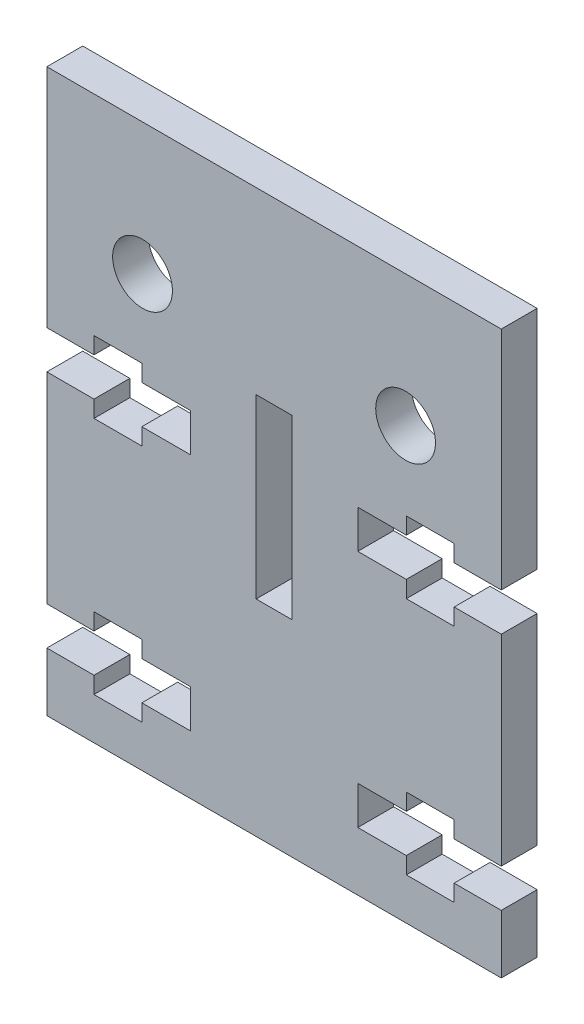
from build123d import *

# Parameters (mm, degrees)
SKETCH1_W           = 38
SKETCH1_H           = 47
BOSS_EXTRUDE1_DEPTH = 3
SKETCH2_R           = 2.5
CUT_EXTRUDE1_DEPTH  = 3
CUT_EXTRUDE2_DEPTH  = 3
SKETCH4_W           = 3
SKETCH4_H           = 14.8
CUT_EXTRUDE3_DEPTH  = 10


with BuildPart() as part:
    # Sketch1 → Boss-Extrude1 (new body)
    with BuildSketch(Plane.XY):
        with Locations((0, -6.895095368)):
            Rectangle(SKETCH1_W, SKETCH1_H)
    extrude(amount=BOSS_EXTRUDE1_DEPTH)

    # Sketch2 → Cut-Extrude1 (cut)
    with BuildSketch(Plane.XY.offset(3)):
        with Locations((-11, 5.604904632)):
            Circle(SKETCH2_R)
        with Locations(Location((11, 5.604904632, 0), (0, 0, 180))):
            Circle(SKETCH2_R)
    extrude(amount=-CUT_EXTRUDE1_DEPTH, mode=Mode.SUBTRACT)

    # Sketch3 → Cut-Extrude2 (cut)
    with BuildSketch(Plane.XY.offset(3)):
        Polygon((-7, -5.495095368), (-11.059072882, -5.495095368), (-11.059072882, -6.895095368), (-15.059072882, -6.895095368), (-15.059072882, -5.495095368), (-19, -5.495095368), (-19, -2.295095368), (-15.059072882, -2.295095368), (-15.059072882, -0.895095368), (-11.059072882, -0.895095368), (-11.059072882, -2.295095368), (-7, -2.295095368), align=None)
        Polygon((7, -5.495095368), (11.059072882, -5.495095368), (11.059072882, -6.895095368), (15.059072882, -6.895095368), (15.059072882, -5.495095368), (19, -5.495095368), (19, -2.295095368), (15.059072882, -2.295095368), (15.059072882, -0.895095368), (11.059072882, -0.895095368), (11.059072882, -2.295095368), (7, -2.295095368), align=None)
        Polygon((-7, -25.495095368), (-7, -22.295095368), (-11.059072882, -22.295095368), (-11.059072882, -20.895095368), (-15.059072882, -20.895095368), (-15.059072882, -22.295095368), (-19, -22.295095368), (-19, -25.495095368), (-15.059072882, -25.495095368), (-15.059072882, -26.895095368), (-11.059072882, -26.895095368), (-11.059072882, -25.495095368), align=None)
        Polygon((7, -25.495095368), (11.059072882, -25.495095368), (11.059072882, -26.895095368), (15.059072882, -26.895095368), (15.059072882, -25.495095368), (19, -25.495095368), (19, -22.295095368), (15.059072882, -22.295095368), (15.059072882, -20.895095368), (11.059072882, -20.895095368), (11.059072882, -22.295095368), (7, -22.295095368), align=None)
    extrude(amount=-CUT_EXTRUDE2_DEPTH, mode=Mode.SUBTRACT)

    # Sketch4 → Cut-Extrude3 (cut)
    with BuildSketch(Plane.XY.offset(3)):
        with Locations((0, -5.795095368)):
            Rectangle(SKETCH4_W, SKETCH4_H)
    extrude(amount=-CUT_EXTRUDE3_DEPTH, mode=Mode.SUBTRACT)


solid = part.part
